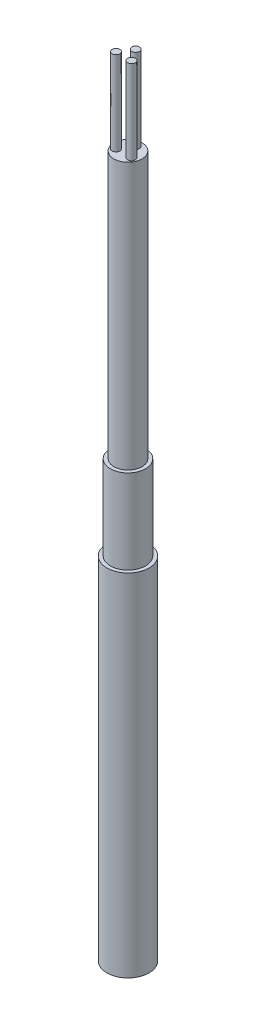
from build123d import *

# Parameters (mm, degrees)
SK_STAINLESS_SHEATH_R  = 3
STAINLESS_SHEATH_DEPTH = 50
SLEEVE_START           = 50
SK_SLEEVE_R            = 2.5
SLEEVE_DEPTH           = 12
CABLE_START            = 62
SK_CABLE_R             = 2
CABLE_DEPTH            = 38
WIRE_START             = 100
SK_WIRE_RED_VDD_R      = 0.55
WIRE_RED_VDD_DEPTH     = 12
SK_WIRE_BLACK_GND_R    = 0.55
WIRE_BLACK_GND_DEPTH   = 12
SK_WIRE_YELLOW_DQ_R    = 0.55
WIRE_YELLOW_DQ_DEPTH   = 12


with BuildPart() as part:
    # SK Stainless sheath → Stainless sheath (new body)
    with BuildSketch(Plane(origin=(0, 0, 0), x_dir=(1, 0, 0), z_dir=(0, 1, 0))):
        with Locations(Location((0, 0, 0), (0, 0, 270))):
            Circle(SK_STAINLESS_SHEATH_R)
    extrude(amount=STAINLESS_SHEATH_DEPTH)


with BuildPart() as body_2:
    # SK Sleeve → Sleeve (new body)
    with BuildSketch(Plane(origin=(0, 0, 0), x_dir=(1, 0, 0), z_dir=(0, 1, 0)).offset(SLEEVE_START)):
        with Locations(Location((0, 0, 0), (0, 0, 270))):
            Circle(SK_SLEEVE_R)
    extrude(amount=SLEEVE_DEPTH)


with BuildPart() as body_3:
    # SK Cable → Cable (new body)
    with BuildSketch(Plane(origin=(0, 0, 0), x_dir=(1, 0, 0), z_dir=(0, 1, 0)).offset(CABLE_START)):
        with Locations(Location((0, 0, 0), (0, 0, 270))):
            Circle(SK_CABLE_R)
    extrude(amount=CABLE_DEPTH)


with BuildPart() as body_4:
    # SK Wire red VDD → Wire red VDD (new body)
    with BuildSketch(Plane(origin=(0, 0, 0), x_dir=(1, 0, 0), z_dir=(0, 1, 0)).offset(WIRE_START)):
        with Locations(Location((-1.1, -0.6, 0), (0, 0, 270))):
            Circle(SK_WIRE_RED_VDD_R)
    extrude(amount=WIRE_RED_VDD_DEPTH)


with BuildPart() as body_5:
    # SK Wire black GND → Wire black GND (new body)
    with BuildSketch(Plane(origin=(0, 0, 0), x_dir=(1, 0, 0), z_dir=(0, 1, 0)).offset(WIRE_START)):
        with Locations(Location((1.1, -0.6, 0), (0, 0, 270))):
            Circle(SK_WIRE_BLACK_GND_R)
    extrude(amount=WIRE_BLACK_GND_DEPTH)


with BuildPart() as body_6:
    # SK Wire yellow DQ → Wire yellow DQ (new body)
    with BuildSketch(Plane(origin=(0, 0, 0), x_dir=(1, 0, 0), z_dir=(0, 1, 0)).offset(WIRE_START)):
        with Locations(Location((0, 1.1, 0), (0, 0, 270))):
            Circle(SK_WIRE_YELLOW_DQ_R)
    extrude(amount=WIRE_YELLOW_DQ_DEPTH)


solid = Compound([part.part, body_2.part, body_3.part, body_4.part, body_5.part, body_6.part])
